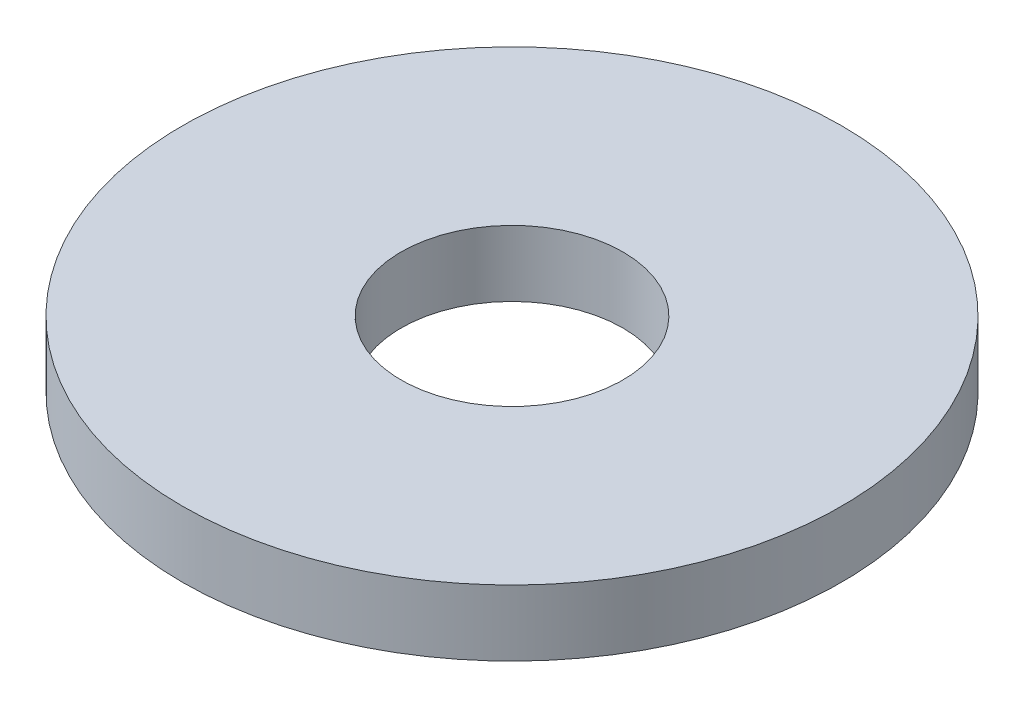
from build123d import *

# Parameters (mm, degrees)
SKETCH1_R           = 1.5
BOSS_EXTRUDE1_DEPTH = 0.3
SKETCH2_R           = 0.505
CUT_EXTRUDE1_DEPTH  = 3.142428529


with BuildPart() as part:
    # Sketch1 → Boss-Extrude1 (new body)
    with BuildSketch(Plane(origin=(0, 0, 0), x_dir=(1, 0, 0), z_dir=(0, 1, 0))):
        with Locations(Location((0, 0, 0), (0, 0, 270))):
            Circle(SKETCH1_R)
    extrude(amount=BOSS_EXTRUDE1_DEPTH)

    # Sketch2 → Cut-Extrude1 (cut, through all)
    with BuildSketch(Plane.XZ):
        with Locations(Location((0, 0, 0), (0, 0, 270))):
            Circle(SKETCH2_R)
    extrude(amount=-CUT_EXTRUDE1_DEPTH, mode=Mode.SUBTRACT)


solid = part.part
